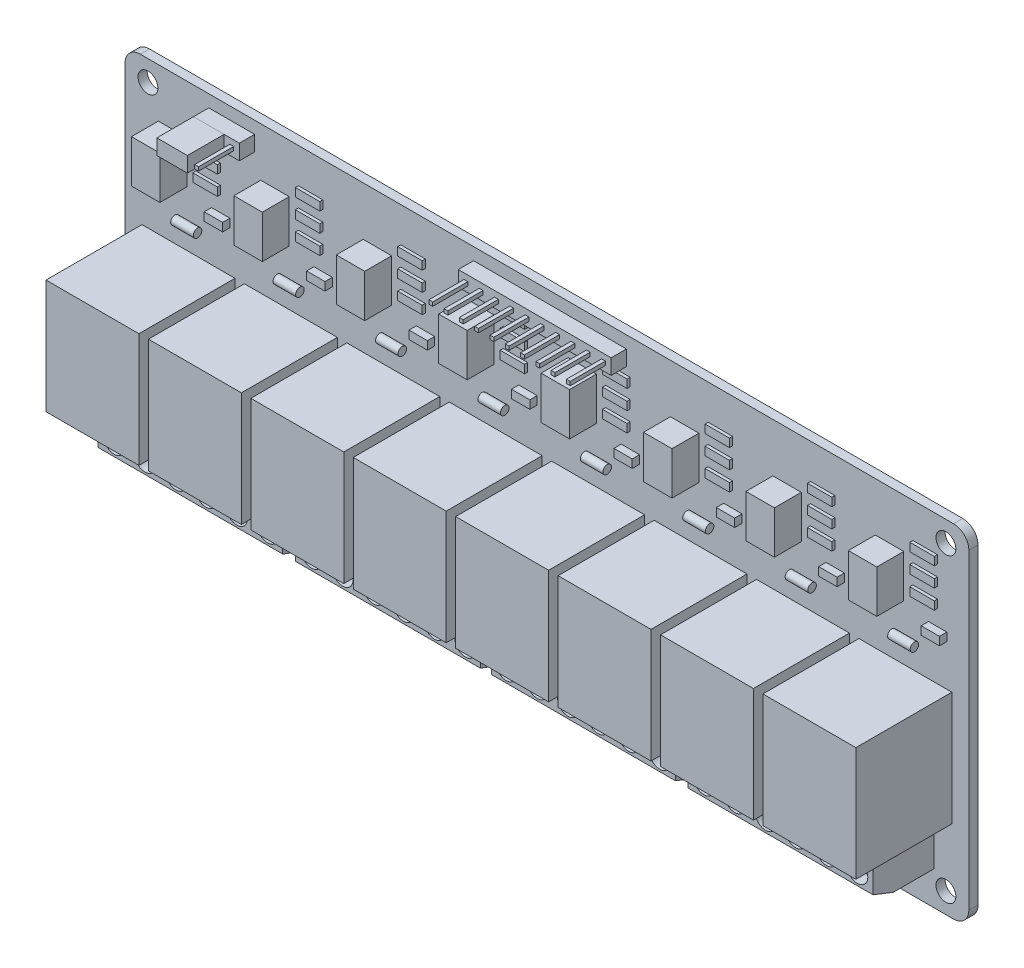
from build123d import *

# Parameters (mm, degrees)
SKETCH1_W               = 138
SKETCH1_H               = 56
SKETCH1_R               = 1.625
BOSS_EXTRUDE1_DEPTH     = 1.5
FILLET1_R               = 2.5
SKETCH2_W               = 15.2
SKETCH2_H               = 18.65
BOSS_EXTRUDE2_DEPTH     = 15.7
SKETCH3_W               = 4.65
SKETCH3_H               = 7
BOSS_EXTRUDE3_DEPTH     = 4.4
BOSS_EXTRUDE4_START     = -8.2
SKETCH4_R               = 0.7
BOSS_EXTRUDE4_DEPTH     = 3.7
SKETCH5_W               = 3
SKETCH5_H               = 1.35
BOSS_EXTRUDE5_DEPTH     = 1.2
SKETCH6_W               = 4
SKETCH6_H               = 1.35
BOSS_EXTRUDE6_DEPTH     = 0.5
LPATTERN1_COUNT         = 8
LPATTERN1_PITCH         = 16.75
BOSS_EXTRUDE7_START     = -5.675
BOSS_EXTRUDE7_DEPTH     = 126.75
CUT_EXTRUDE1_REACH      = 89.19
SKETCH8_W               = 1.8
SKETCH8_H               = 10
SKETCH8_W_2             = 2.1
SKETCH9_R               = 1.7
CUT_EXTRUDE2_DEPTH      = 2
MIRROR2_COPY_1_SKETCH_R = 1.7
MIRROR2_COPY_1_DEPTH    = 2
SKETCH11_W              = 2.5
SKETCH11_H              = 2.5
BOSS_EXTRUDE9_DEPTH     = 2.5
SKETCH12_W              = 0.62
SKETCH12_H              = 0.62
BOSS_EXTRUDE10_DEPTH    = 5.75
LPATTERN2_COUNT         = 3
LPATTERN2_PITCH         = 2.5
SKETCH13_W              = 5
SKETCH13_H              = 2.5
BOSS_EXTRUDE11_DEPTH    = 6
SKETCH15_W              = 2.5
SKETCH15_H              = 2.5
BOSS_EXTRUDE12_DEPTH    = 2.5
SKETCH16_W              = 0.62
SKETCH16_H              = 0.62
BOSS_EXTRUDE13_DEPTH    = 5.75
LPATTERN5_COUNT         = 10
LPATTERN5_PITCH         = 2.5


with BuildPart() as part:
    # Sketch1 → Boss-Extrude1 (new body)
    with BuildSketch(Plane.XY):
        Rectangle(SKETCH1_W, SKETCH1_H)
        with Locations((-65.25, 24.625)):
            Circle(SKETCH1_R, mode=Mode.SUBTRACT)
        with Locations((-65.25, -24.625)):
            Circle(SKETCH1_R, mode=Mode.SUBTRACT)
        with Locations((65.25, -24.625)):
            Circle(SKETCH1_R, mode=Mode.SUBTRACT)
        with Locations((65.25, 24.625)):
            Circle(SKETCH1_R, mode=Mode.SUBTRACT)
    extrude(amount=BOSS_EXTRUDE1_DEPTH)

    # Fillet1
    fillet1_edges = [part.edges().sort_by_distance(p)[0] for p in [
        (-69, 28, 0.75),
        (69, 28, 0.75),
        (69, -28, 0.75),
        (-69, -28, 0.75),
    ]]
    fillet(fillet1_edges, radius=FILLET1_R)

    # Sketch2 → Boss-Extrude2 (add)
    with BuildSketch(Plane.XY.offset(1.5)):
        with Locations((58.625, -5.325)):
            Rectangle(SKETCH2_W, SKETCH2_H)
    boss_extrude2 = extrude(amount=BOSS_EXTRUDE2_DEPTH)

    # Sketch3 → Boss-Extrude3 (add)
    with BuildSketch(Plane.XY.offset(1.5)):
        with Locations((56.025, 16.5)):
            Rectangle(SKETCH3_W, SKETCH3_H)
    boss_extrude3 = extrude(amount=BOSS_EXTRUDE3_DEPTH)

    # Sketch4 → Boss-Extrude4 (add)
    with BuildSketch(Plane(origin=(69, 0, 0), x_dir=(0, 0, -1), z_dir=(1, 0, 0)).offset(BOSS_EXTRUDE4_START)):
        with Locations((-2.19, 8.05)):
            Circle(SKETCH4_R)
    boss_extrude4 = extrude(amount=-BOSS_EXTRUDE4_DEPTH)

    # Sketch5 → Boss-Extrude5 (add)
    with BuildSketch(Plane.XY.offset(1.5)):
        with Locations((63.9, 11.425)):
            Rectangle(SKETCH5_W, SKETCH5_H)
    boss_extrude5 = extrude(amount=BOSS_EXTRUDE5_DEPTH)

    # Sketch6 → Boss-Extrude6 (add)
    with BuildSketch(Plane.XY.offset(1.5)):
        with Locations((61.85, 15.325)):
            Rectangle(SKETCH6_W, SKETCH6_H)
        with Locations((61.85, 18.475)):
            Rectangle(SKETCH6_W, SKETCH6_H)
        with Locations((61.85, 21.625)):
            Rectangle(SKETCH6_W, SKETCH6_H)
    boss_extrude6 = extrude(amount=BOSS_EXTRUDE6_DEPTH)

    # LPattern1: Boss-Extrude2, Boss-Extrude3, Boss-Extrude4, Boss-Extrude5, Boss-Extrude6 ×8
    with Locations(*[(-i * LPATTERN1_PITCH, 0, 0) for i in range(1, LPATTERN1_COUNT)]):
        add(boss_extrude2)
        add(boss_extrude3)
        add(boss_extrude4)
        add(boss_extrude5)
        add(boss_extrude6)

    # Sketch7 → Boss-Extrude7 (add)
    with BuildSketch(Plane(origin=(69, 0, 0), x_dir=(0, 0, -1), z_dir=(1, 0, 0)).offset(BOSS_EXTRUDE7_START)):
        Polygon((-1.5, -15.45), (-8.2, -15.45), (-11.5, -17.05), (-11.5, -21.15), (-8.2, -22.45), (-1.5, -22.45), align=None)
    extrude(amount=-BOSS_EXTRUDE7_DEPTH)

    # Cut-Extrude1: up to this face of the body (flat: up to its plane)
    cut_extrude1_end = Plane(part.part.faces().sort_by_distance((-0.05, -15.45, 4.85))[0])
    # Sketch8 → Cut-Extrude1 (cut, up to the picked face)
    with BuildSketch(Plane.XZ.offset(22.45), mode=Mode.PRIVATE) as cut_extrude1_sk1:
        with Locations((0, 6.5)):
            Rectangle(SKETCH8_W, SKETCH8_H)
    cut_extrude1_tool1 = split(extrude(cut_extrude1_sk1.sketch, amount=-CUT_EXTRUDE1_REACH, mode=Mode.PRIVATE), bisect_by=cut_extrude1_end, keep=Keep.BOTH, mode=Mode.PRIVATE)
    # Sketch8 → Cut-Extrude1 (cut, up to the picked face)
    with BuildSketch(Plane.XZ.offset(22.45), mode=Mode.PRIVATE) as cut_extrude1_sk2:
        with Locations((-32.1625, 6.5)):
            Rectangle(SKETCH8_W_2, SKETCH8_H)
    cut_extrude1_tool2 = split(extrude(cut_extrude1_sk2.sketch, amount=-CUT_EXTRUDE1_REACH, mode=Mode.PRIVATE), bisect_by=cut_extrude1_end, keep=Keep.BOTH, mode=Mode.PRIVATE)
    # Sketch8 → Cut-Extrude1 (cut, up to the picked face)
    with BuildSketch(Plane.XZ.offset(22.45), mode=Mode.PRIVATE) as cut_extrude1_sk3:
        with Locations((32.0625, 6.5)):
            Rectangle(SKETCH8_W_2, SKETCH8_H)
    cut_extrude1_tool3 = split(extrude(cut_extrude1_sk3.sketch, amount=-CUT_EXTRUDE1_REACH, mode=Mode.PRIVATE), bisect_by=cut_extrude1_end, keep=Keep.BOTH, mode=Mode.PRIVATE)
    add(cut_extrude1_tool1.solids().sort_by(Axis((0, -22.45, 6.5), (0, 1, 0)))[0], mode=Mode.SUBTRACT)
    add(cut_extrude1_tool2.solids().sort_by(Axis((-32.1625, -22.45, 6.5), (0, 1, 0)))[0], mode=Mode.SUBTRACT)
    add(cut_extrude1_tool3.solids().sort_by(Axis((32.0625, -22.45, 6.5), (0, 1, 0)))[0], mode=Mode.SUBTRACT)

    # Sketch9 → Cut-Extrude2 (cut)
    with BuildSketch(Plane.XY.offset(11.5)):
        with Locations((60.775, -19.1)):
            Circle(SKETCH9_R)
        with Locations((55.725, -19.1)):
            Circle(SKETCH9_R)
        with Locations((50.675, -19.1)):
            Circle(SKETCH9_R)
        with Locations((45.7625, -19.1)):
            Circle(SKETCH9_R)
        with Locations((40.7125, -19.1)):
            Circle(SKETCH9_R)
        with Locations((35.6625, -19.1)):
            Circle(SKETCH9_R)
    cut_extrude2 = extrude(amount=-CUT_EXTRUDE2_DEPTH, mode=Mode.SUBTRACT)

    # Mirror1: Cut-Extrude2 across plane
    add(cut_extrude2.mirror(Plane(origin=(32.0625, 0, 0), x_dir=(0, 0, 1), z_dir=(1, 0, 0))), mode=Mode.SUBTRACT)

    # Mirror2: Cut-Extrude2 across plane
    add(cut_extrude2.mirror(Plane(origin=(0, 0, 0), x_dir=(0, 0, 1), z_dir=(1, 0, 0))), mode=Mode.SUBTRACT)

    # Mirror2 copy 1 sketch → Mirror2 copy 1 (cut)
    with BuildSketch(Plane(origin=(-64.125, 0, 11.5), x_dir=(1, 0, 0), z_dir=(0, 0, 1))):
        with Locations((60.775, -19.1)):
            Circle(MIRROR2_COPY_1_SKETCH_R)
        with Locations((55.725, -19.1)):
            Circle(MIRROR2_COPY_1_SKETCH_R)
        with Locations((50.675, -19.1)):
            Circle(MIRROR2_COPY_1_SKETCH_R)
        with Locations((45.7625, -19.1)):
            Circle(MIRROR2_COPY_1_SKETCH_R)
        with Locations((40.7125, -19.1)):
            Circle(MIRROR2_COPY_1_SKETCH_R)
        with Locations((35.6625, -19.1)):
            Circle(MIRROR2_COPY_1_SKETCH_R)
    extrude(amount=-MIRROR2_COPY_1_DEPTH, mode=Mode.SUBTRACT)

    # Sketch11 → Boss-Extrude9 (add)
    with BuildSketch(Plane.XY.offset(1.5)):
        with Locations((-54.05, 24.75)):
            Rectangle(SKETCH11_W, SKETCH11_H)
    boss_extrude9 = extrude(amount=BOSS_EXTRUDE9_DEPTH)

    # Sketch12 → Boss-Extrude10 (add)
    with BuildSketch(Plane.XY.offset(4)):
        with Locations((-54.05, 24.75)):
            Rectangle(SKETCH12_W, SKETCH12_H)
    boss_extrude10 = extrude(amount=BOSS_EXTRUDE10_DEPTH)

    # LPattern2: Boss-Extrude9, Boss-Extrude10 ×3
    with Locations(*[(i * LPATTERN2_PITCH, 0, 0) for i in range(1, LPATTERN2_COUNT)]):
        add(boss_extrude9)
        add(boss_extrude10)

    # Sketch15 → Boss-Extrude12 (add)
    with BuildSketch(Plane.XY.offset(1.5)):
        with Locations((11.75, 24.75)):
            Rectangle(SKETCH15_W, SKETCH15_H)
    boss_extrude12 = extrude(amount=BOSS_EXTRUDE12_DEPTH)

    # Sketch16 → Boss-Extrude13 (add)
    with BuildSketch(Plane.XY.offset(4)):
        with Locations((11.75, 24.75)):
            Rectangle(SKETCH16_W, SKETCH16_H)
    boss_extrude13 = extrude(amount=BOSS_EXTRUDE13_DEPTH)

    # LPattern5: Boss-Extrude12, Boss-Extrude13 ×10
    with Locations(*[(-i * LPATTERN5_PITCH, 0, 0) for i in range(1, LPATTERN5_COUNT)]):
        add(boss_extrude12)
        add(boss_extrude13)


with BuildPart() as body_2:
    # Sketch13 → Boss-Extrude11 (new body)
    with BuildSketch(Plane.XY.offset(4)):
        with Locations((-52.8, 24.75)):
            Rectangle(SKETCH13_W, SKETCH13_H)
    extrude(amount=BOSS_EXTRUDE11_DEPTH)


solid = Compound([part.part, body_2.part])
